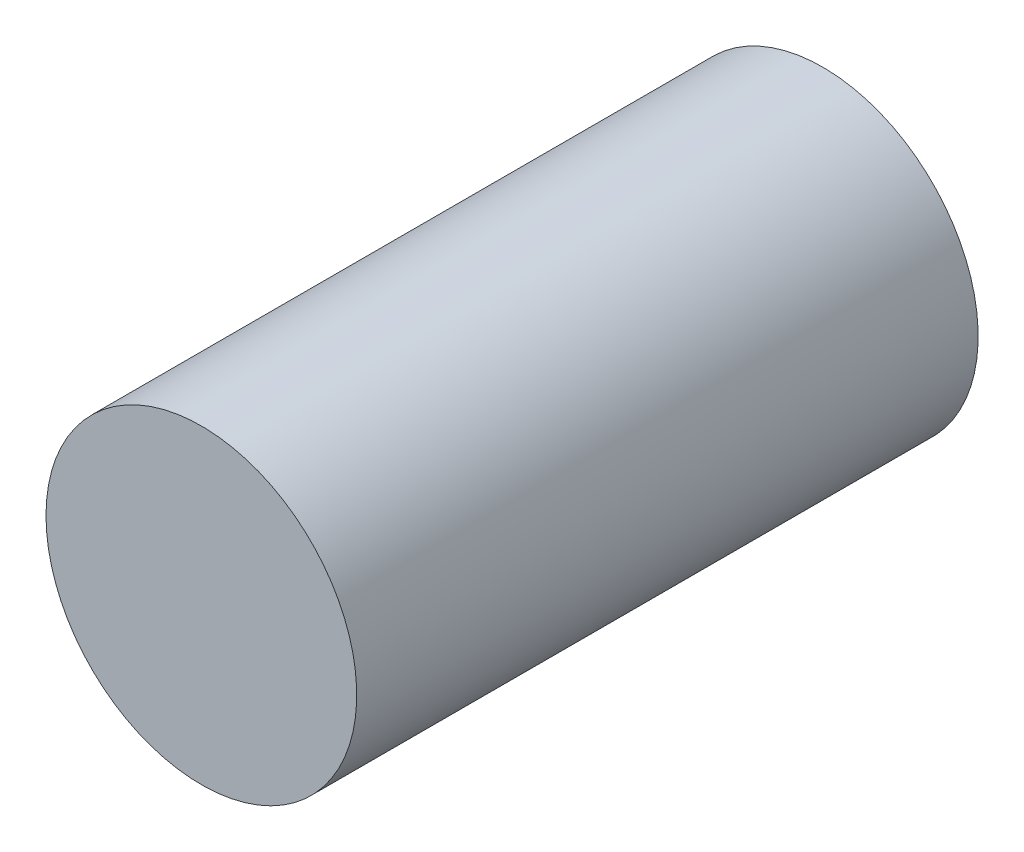
from build123d import *

# Parameters (mm, degrees)
SKETCH1_R           = 152.4
BOSS_EXTRUDE1_DEPTH = 609.6


with BuildPart() as part:
    # Sketch1 → Boss-Extrude1 (new body)
    with BuildSketch(Plane.XY):
        with Locations(Location((0, 0, 0), (0, 0, 180))):
            Circle(SKETCH1_R)
    extrude(amount=BOSS_EXTRUDE1_DEPTH)


solid = part.part
